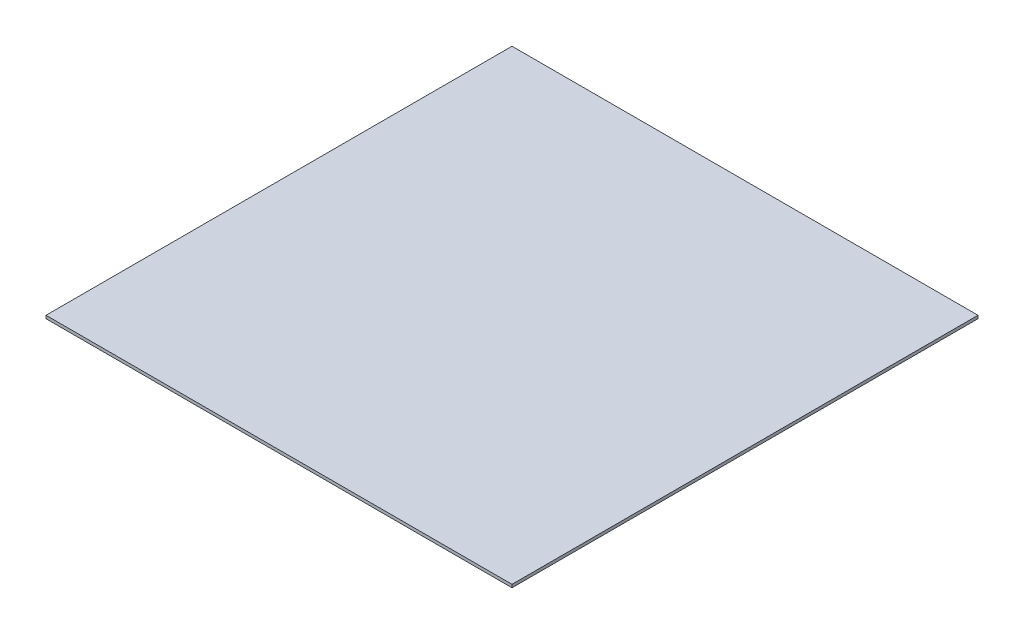
from build123d import *

# Parameters (mm, degrees)
SKETCH1_W           = 310
SKETCH1_H           = 310
BOSS_EXTRUDE1_DEPTH = 2


with BuildPart() as part:
    # Sketch1 → Boss-Extrude1 (new body)
    with BuildSketch(Plane(origin=(0, 0, 0), x_dir=(1, 0, 0), z_dir=(0, 1, 0))):
        Rectangle(SKETCH1_W, SKETCH1_H)
    extrude(amount=BOSS_EXTRUDE1_DEPTH)


solid = part.part
